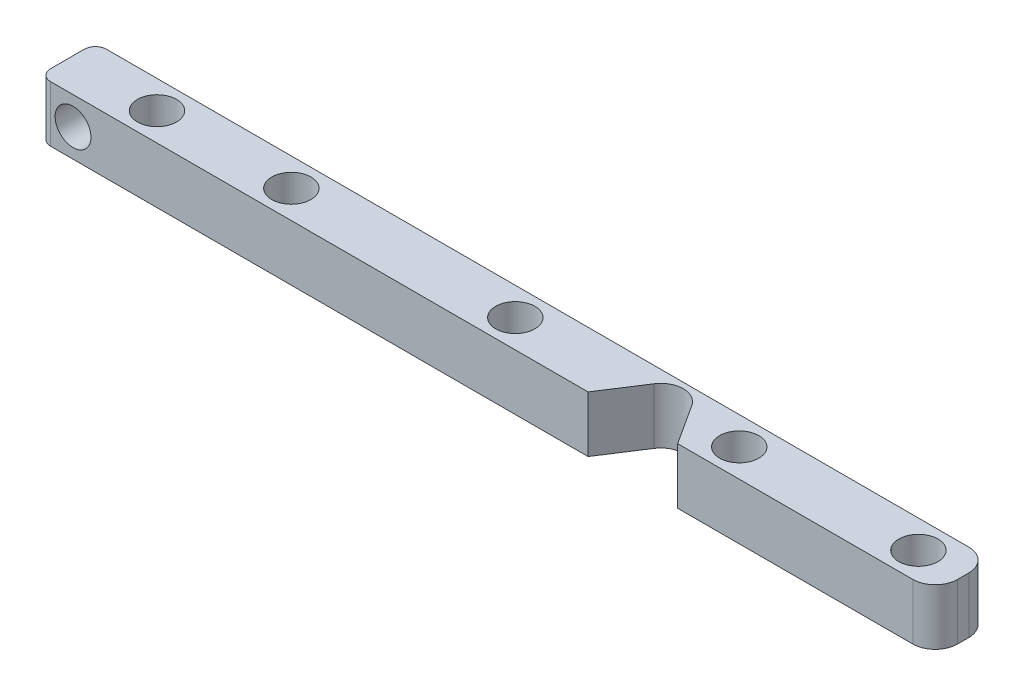
from build123d import *

# Parameters (mm, degrees)
SKETCH1_W           = 101.6
SKETCH1_H           = 6.35
BOSS_EXTRUDE1_DEPTH = 6.35
FILLET1_R           = 2.54
FILLET2_R           = 1.27
CUT_EXTRUDE1_REACH  = 53.294
SKETCH2_R           = 2.2225
CUT_EXTRUDE2_REACH  = 53.588
SKETCH3_R           = 2.032
CUT_EXTRUDE3_REACH  = 53.294


with BuildPart() as part:
    # Sketch1 → Boss-Extrude1 (new body)
    with BuildSketch(Plane(origin=(0, 0, 0), x_dir=(1, 0, 0), z_dir=(0, 1, 0))):
        Rectangle(SKETCH1_W, SKETCH1_H)
    extrude(amount=BOSS_EXTRUDE1_DEPTH)

    # Fillet1
    fillet1_edges = [part.edges().sort_by_distance(p)[0] for p in [
        (50.8, 3.175, 3.175),
        (50.8, 3.175, -3.175),
    ]]
    fillet(fillet1_edges, radius=FILLET1_R)

    # Fillet2
    fillet2_edges = [part.edges().sort_by_distance(p)[0] for p in [
        (-50.8, 3.175, 3.175),
        (-50.8, 3.175, -3.175),
    ]]
    fillet(fillet2_edges, radius=FILLET2_R)

    # Sketch2 → Cut-Extrude1 (cut, up to next)
    with BuildSketch(Plane(origin=(0, 6.35, 0), x_dir=(1, 0, 0), z_dir=(0, 1, 0)), mode=Mode.PRIVATE) as cut_extrude1_sk1:
        with Locations(Location((-40.64, 0, 0), (0, 0, 270))):
            Circle(SKETCH2_R)
    cut_extrude1_tool1 = extrude(cut_extrude1_sk1.sketch, amount=-CUT_EXTRUDE1_REACH, mode=Mode.PRIVATE) & part.part
    # Sketch2 → Cut-Extrude1 (cut, up to next)
    with BuildSketch(Plane(origin=(0, 6.35, 0), x_dir=(1, 0, 0), z_dir=(0, 1, 0)), mode=Mode.PRIVATE) as cut_extrude1_sk2:
        with Locations(Location((45.72, 0, 0), (0, 0, 270))):
            Circle(SKETCH2_R)
    cut_extrude1_tool2 = extrude(cut_extrude1_sk2.sketch, amount=-CUT_EXTRUDE1_REACH, mode=Mode.PRIVATE) & part.part
    # Sketch2 → Cut-Extrude1 (cut, up to next)
    with BuildSketch(Plane(origin=(0, 6.35, 0), x_dir=(1, 0, 0), z_dir=(0, 1, 0)), mode=Mode.PRIVATE) as cut_extrude1_sk3:
        with Locations(Location((25.4, 0, 0), (0, 0, 270))):
            Circle(SKETCH2_R)
    cut_extrude1_tool3 = extrude(cut_extrude1_sk3.sketch, amount=-CUT_EXTRUDE1_REACH, mode=Mode.PRIVATE) & part.part
    # Sketch2 → Cut-Extrude1 (cut, up to next)
    with BuildSketch(Plane(origin=(0, 6.35, 0), x_dir=(1, 0, 0), z_dir=(0, 1, 0)), mode=Mode.PRIVATE) as cut_extrude1_sk4:
        with Locations(Location((-25.4, 0, 0), (0, 0, 270))):
            Circle(SKETCH2_R)
    cut_extrude1_tool4 = extrude(cut_extrude1_sk4.sketch, amount=-CUT_EXTRUDE1_REACH, mode=Mode.PRIVATE) & part.part
    # Sketch2 → Cut-Extrude1 (cut, up to next)
    with BuildSketch(Plane(origin=(0, 6.35, 0), x_dir=(1, 0, 0), z_dir=(0, 1, 0)), mode=Mode.PRIVATE) as cut_extrude1_sk5:
        with Locations(Location((0, 0, 0), (0, 0, 270))):
            Circle(SKETCH2_R)
    cut_extrude1_tool5 = extrude(cut_extrude1_sk5.sketch, amount=-CUT_EXTRUDE1_REACH, mode=Mode.PRIVATE) & part.part
    add(cut_extrude1_tool1.solids().sort_by_distance((-40.64, 6.35, 0))[0], mode=Mode.SUBTRACT)
    add(cut_extrude1_tool2.solids().sort_by_distance((45.72, 6.35, 0))[0], mode=Mode.SUBTRACT)
    add(cut_extrude1_tool3.solids().sort_by_distance((25.4, 6.35, 0))[0], mode=Mode.SUBTRACT)
    add(cut_extrude1_tool4.solids().sort_by_distance((-25.4, 6.35, 0))[0], mode=Mode.SUBTRACT)
    add(cut_extrude1_tool5.solids().sort_by_distance((0, 6.35, 0))[0], mode=Mode.SUBTRACT)

    # Sketch3 → Cut-Extrude2 (cut, up to next)
    with BuildSketch(Plane.XY.offset(3.175), mode=Mode.PRIVATE) as cut_extrude2_sk1:
        with Locations((-46.99, 3.175)):
            Circle(SKETCH3_R)
    cut_extrude2_tool1 = extrude(cut_extrude2_sk1.sketch, amount=-CUT_EXTRUDE2_REACH, mode=Mode.PRIVATE) & part.part
    add(cut_extrude2_tool1.solids().sort_by_distance((-46.99, 3.175, 3.175))[0], mode=Mode.SUBTRACT)

    # Sketch4 → Cut-Extrude3 (cut, up to next)
    with BuildSketch(Plane(origin=(0, 6.35, 0), x_dir=(1, 0, 0), z_dir=(0, 1, 0)), mode=Mode.PRIVATE) as cut_extrude3_sk1:
        with BuildLine():
            Line((21.59, -3.175), (18.642458961, 1.379934338))
            ThreePointArc((18.642458961, 1.379934338), (16.51, 2.54), (14.377541039, 1.379934338))
            Line((14.377541039, 1.379934338), (11.43, -3.175))
            Line((11.43, -3.175), (21.59, -3.175))
        make_face()
    cut_extrude3_tool1 = extrude(cut_extrude3_sk1.sketch, amount=-CUT_EXTRUDE3_REACH, mode=Mode.PRIVATE) & part.part
    add(cut_extrude3_tool1.solids().sort_by_distance((16.51, 6.35, 0.914009))[0], mode=Mode.SUBTRACT)


solid = part.part
